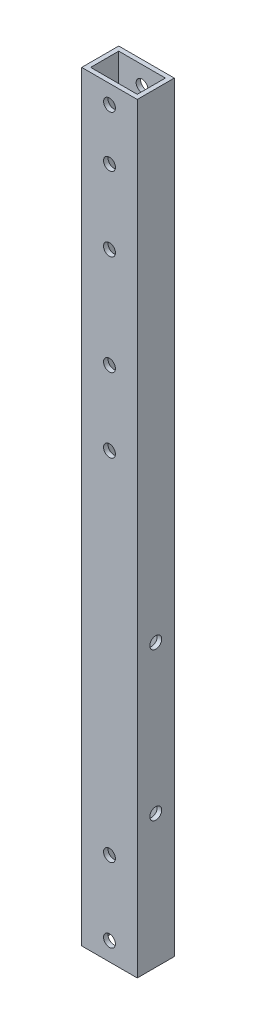
from build123d import *

# Parameters (mm, degrees)
SKETCH_1_W          = 15
SKETCH_1_H          = 10
SKETCH_1_W_2        = 12.6
SKETCH_1_H_2        = 7.6
EXTRUDE_1_DEPTH     = 110
SKETCH_2_R          = 1.6
CUT_EXTRUDE_1_DEPTH = 100
SKETCH_3_R          = 1.6
CUT_EXTRUDE_2_DEPTH = 15
SKETCH_5_W          = 15
SKETCH_5_H          = 10
CUT_EXTRUDE_4_DEPTH = 14.5
SKETCH_6_R          = 1.6
CUT_EXTRUDE_5_DEPTH = 15
SKETCH_7_R          = 1.6
CUT_EXTRUDE_6_DEPTH = 10


with BuildPart() as part:
    # ｽｹｯﾁ1 → ﾎﾞｽ - 押し出し1 (new, symmetric)
    with BuildSketch(Plane(origin=(0, 0, 0), x_dir=(1, 0, 0), z_dir=(0, 1, 0))):
        Rectangle(SKETCH_1_W, SKETCH_1_H)
        Rectangle(SKETCH_1_W_2, SKETCH_1_H_2, mode=Mode.SUBTRACT)
    extrude(amount=EXTRUDE_1_DEPTH, both=True)

    # ｽｹｯﾁ2 → ｶｯﾄ - 押し出し1 (cut)
    with BuildSketch(Plane(origin=(0, 0, -5), x_dir=(-1, 0, 0), z_dir=(0, 0, -1))):
        with Locations((0, -85)):
            Circle(SKETCH_2_R)
        with Locations((0, -105)):
            Circle(SKETCH_2_R)
    extrude(amount=-CUT_EXTRUDE_1_DEPTH, mode=Mode.SUBTRACT)

    # ｽｹｯﾁ3 → ｶｯﾄ - 押し出し2 (cut)
    with BuildSketch(Plane(origin=(7.5, 0, 0), x_dir=(0, 0, -1), z_dir=(1, 0, 0))):
        with Locations((0, -34)):
            Circle(SKETCH_3_R)
        with Locations((0, -74)):
            Circle(SKETCH_3_R)
    extrude(amount=-CUT_EXTRUDE_2_DEPTH, mode=Mode.SUBTRACT)

    # ｽｹｯﾁ5 → ｶｯﾄ - 押し出し4 (cut)
    with BuildSketch(Plane(origin=(0, 110, 0), x_dir=(1, 0, 0), z_dir=(0, 1, 0))):
        Rectangle(SKETCH_5_W, SKETCH_5_H)
    extrude(amount=-CUT_EXTRUDE_4_DEPTH, mode=Mode.SUBTRACT)

    # ｽｹｯﾁ6 → ｶｯﾄ - 押し出し5 (cut)
    with BuildSketch(Plane(origin=(0, 0, -5), x_dir=(-1, 0, 0), z_dir=(0, 0, -1))):
        with Locations((0, 90.5)):
            Circle(SKETCH_6_R)
        with Locations((0, 76.66)):
            Circle(SKETCH_6_R)
        with Locations((0, 56.66)):
            Circle(SKETCH_6_R)
    extrude(amount=-CUT_EXTRUDE_5_DEPTH, mode=Mode.SUBTRACT)

    # ｽｹｯﾁ7 → ｶｯﾄ - 押し出し6 (cut)
    with BuildSketch(Plane(origin=(0, 0, -5), x_dir=(-1, 0, 0), z_dir=(0, 0, -1))):
        with Locations((0, 9.6)):
            Circle(SKETCH_7_R)
        with Locations((0, 29.6)):
            Circle(SKETCH_7_R)
    extrude(amount=-CUT_EXTRUDE_6_DEPTH, mode=Mode.SUBTRACT)


solid = part.part
